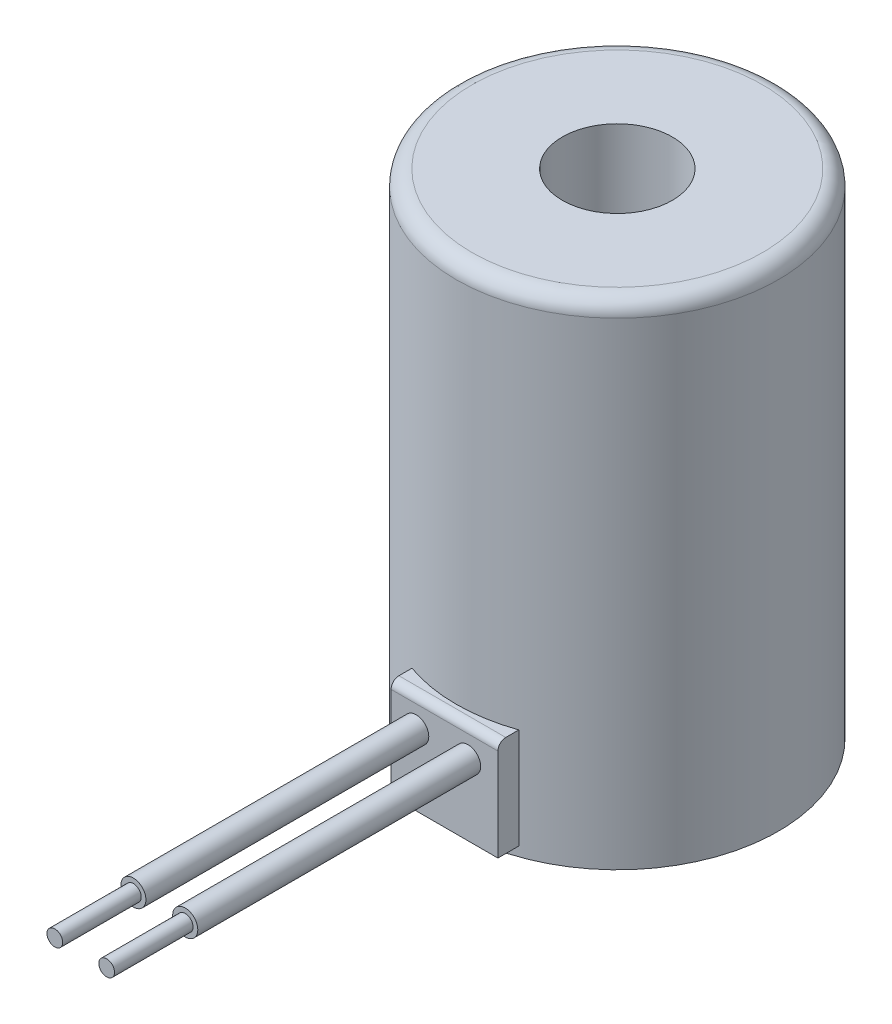
from build123d import *

# Parameters (mm, degrees)
BASE_SKETCH_R       = 10.25
BASE_EXTRUDE_DEPTH  = 15.7
BODY_FILLET_R       = 1
WIRE_BASE_SKETCH_W  = 6.8
WIRE_BASE_SKETCH_H  = 6.4
WIRE_BASE_DEPTH     = 11
WIRE_BASE_FILLET_R  = 0.5
WIRE_START_SKETCH_R = 0.8
WIRE_START_DEPTH    = 18
WIRE_END_SKETCH_R   = 0.5
WIRE_END_DEPTH      = 5
THRU_HOLE_SKETCH_R  = 3.5
THRU_HOLE_DEPTH     = 48.402768906


with BuildPart() as part:
    # Base Sketch → Base Extrude (new, symmetric)
    with BuildSketch(Plane(origin=(0, 0, 0), x_dir=(1, 0, 0), z_dir=(0, 1, 0))):
        with Locations(Location((0, 0, 0), (0, 0, 270))):
            Circle(BASE_SKETCH_R)
    extrude(amount=BASE_EXTRUDE_DEPTH, both=True)

    # Body Fillet
    body_fillet_edges = [part.edges().sort_by_distance(p)[0] for p in [
        (0, 15.7, -10.25),
    ]]
    fillet(body_fillet_edges, radius=BODY_FILLET_R)

    # Wire Base Sketch → Wire Base (add)
    with BuildSketch(Plane.XY):
        with Locations((0, -11.9)):
            Rectangle(WIRE_BASE_SKETCH_W, WIRE_BASE_SKETCH_H)
    extrude(amount=WIRE_BASE_DEPTH)

    # Wire Base Fillet
    wire_base_fillet_edges = [part.edges().sort_by_distance(p)[0] for p in [
        (0, -8.7, 11),
    ]]
    fillet(wire_base_fillet_edges, radius=WIRE_BASE_FILLET_R)

    # Wire Start Sketch → Wire Start (add)
    with BuildSketch(Plane.XY.offset(11)):
        with Locations((-1.8, -10.6)):
            Circle(WIRE_START_SKETCH_R)
        with Locations((1.5, -10.6)):
            Circle(WIRE_START_SKETCH_R)
    extrude(amount=WIRE_START_DEPTH)

    # Wire End Sketch → Wire End (add)
    with BuildSketch(Plane.XY.offset(29)):
        with Locations((1.5, -10.6)):
            Circle(WIRE_END_SKETCH_R)
        with Locations((-1.8, -10.6)):
            Circle(WIRE_END_SKETCH_R)
    extrude(amount=WIRE_END_DEPTH)

    # Thru Hole Sketch → Thru Hole (cut, through all)
    with BuildSketch(Plane(origin=(0, 15.7, 0), x_dir=(1, 0, 0), z_dir=(0, 1, 0))):
        with Locations(Location((0, 0, 0), (0, 0, 270))):
            Circle(THRU_HOLE_SKETCH_R)
    extrude(amount=-THRU_HOLE_DEPTH, mode=Mode.SUBTRACT)


solid = part.part
